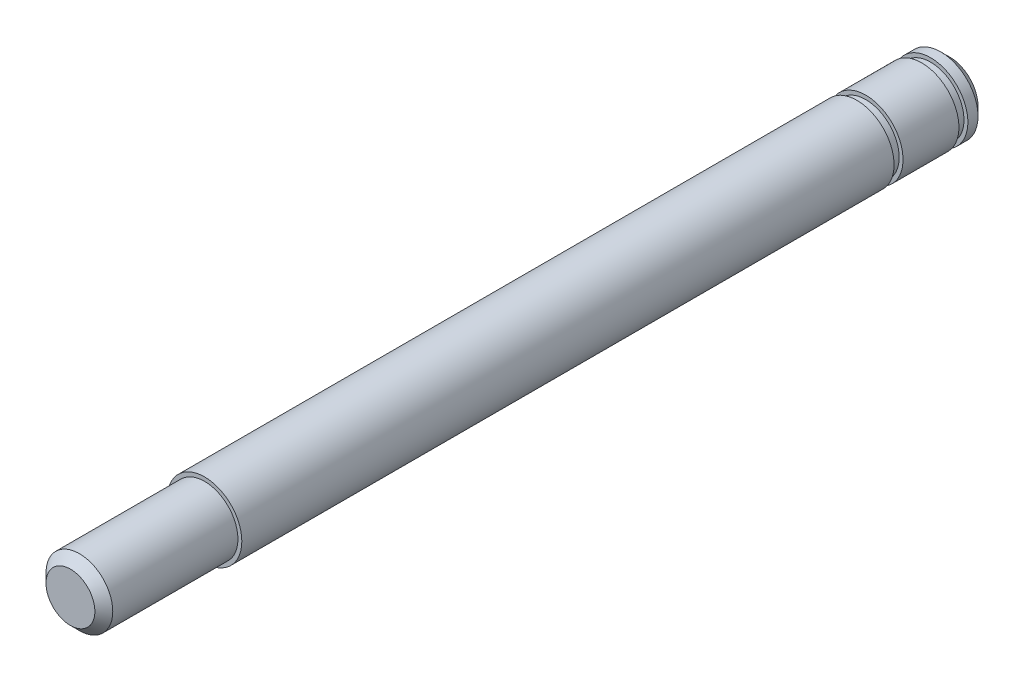
from build123d import *

# Parameters (mm, degrees)
SKETCH1_R           = 1.5875
BOSS_EXTRUDE1_DEPTH = 15.875
SKETCH2_R           = 1.4224
BOSS_EXTRUDE2_DEPTH = 5.715
SKETCH3_R           = 1.5875
SKETCH3_R_2         = 1.4224
CUT_EXTRUDE1_DEPTH  = 0.381
SKETCH4_R           = 1.5875
SKETCH4_R_2         = 1.4224
CUT_EXTRUDE2_DEPTH  = 0.381
CHAMFER1_SIZE       = 0.381


with BuildPart() as part:
    # Sketch1 → Boss-Extrude1 (new, symmetric)
    with BuildSketch(Plane.XY):
        Circle(SKETCH1_R)
    extrude(amount=BOSS_EXTRUDE1_DEPTH, both=True)

    # Sketch2 → Boss-Extrude2 (add)
    with BuildSketch(Plane.XY.offset(15.875)):
        Circle(SKETCH2_R)
    extrude(amount=BOSS_EXTRUDE2_DEPTH)

    # Sketch3 → Cut-Extrude1 (cut)
    with BuildSketch(Plane(origin=(0, 0, -15.0622), x_dir=(-1, 0, 0), z_dir=(0, 0, -1))):
        Circle(SKETCH3_R)
        with Locations(Location((0, 0, 0), (0, 0, 180))):
            Circle(SKETCH3_R_2, mode=Mode.SUBTRACT)
    extrude(amount=-CUT_EXTRUDE1_DEPTH, mode=Mode.SUBTRACT)

    # Sketch4 → Cut-Extrude2 (cut)
    with BuildSketch(Plane(origin=(0, 0, -12.29995), x_dir=(-1, 0, 0), z_dir=(0, 0, -1))):
        Circle(SKETCH4_R)
        Circle(SKETCH4_R_2, mode=Mode.SUBTRACT)
    extrude(amount=-CUT_EXTRUDE2_DEPTH, mode=Mode.SUBTRACT)

    # Chamfer1
    chamfer1_edges = [part.edges().sort_by_distance(p)[0] for p in [
        (-1.5875, 0, -15.875),
        (-1.4224, 0, 21.59),
    ]]
    chamfer(chamfer1_edges, length=CHAMFER1_SIZE)


solid = part.part
